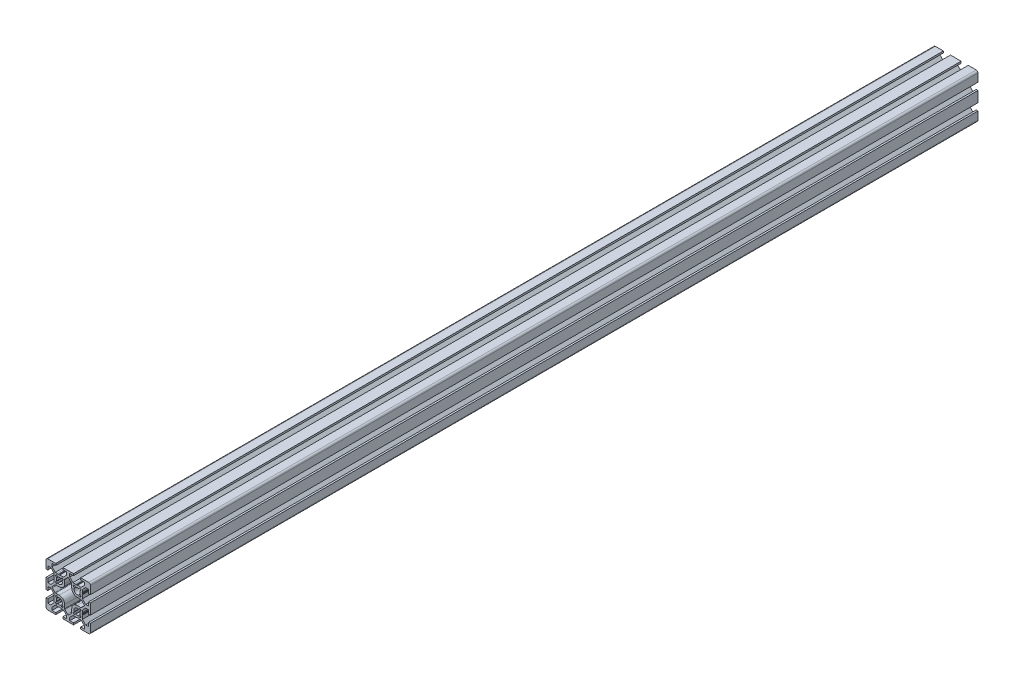
from build123d import *

# Parameters (mm, degrees)
BOSS_EXTRUDE1_DEPTH = 1000
CUT_EXTRUDE1_DEPTH  = 1001.624804809
CUT_EXTRUDE2_DEPTH  = 1001.624804809
CUT_EXTRUDE3_DEPTH  = 1001.624804809
CUT_EXTRUDE4_DEPTH  = 1001.624804809


with BuildPart() as part:
    # Sketch1 → Boss-Extrude1 (new body)
    with BuildSketch(Plane.XY):
        with BuildLine():
            Line((-25, 23), (-25, 14))
            Line((-25, 14), (-23, 14))
            Line((-23, 14), (-23, 18.25))
            Line((-23, 18.25), (-19.664213562, 18.25))
            Line((-19.664213562, 18.25), (-16, 14.585786438))
            Line((-16, 14.585786438), (-16, 10.653589838))
            ThreePointArc((-16, 10.653589838), (-15.982962913, 10.524180316), (-15.933012702, 10.403589838))
            Line((-15.933012702, 10.403589838), (-15.7, 10))
            Line((-15.7, 10), (-15.933012702, 9.596410162))
            ThreePointArc((-15.933012702, 9.596410162), (-16, 9.346410162), (-15.933012702, 9.096410162))
            Line((-15.933012702, 9.096410162), (-15.750976592, 8.781114371))
            Line((-15.750976592, 8.781114371), (-16, 7.5))
            Line((-16, 7.5), (-16, 5.414213562))
            Line((-16, 5.414213562), (-19.664213562, 1.75))
            Line((-19.664213562, 1.75), (-23, 1.75))
            Line((-23, 1.75), (-23, 6))
            Line((-23, 6), (-25, 6))
            Line((-25, 6), (-25, -6))
            Line((-25, -6), (-23, -6))
            Line((-23, -6), (-23, -1.75))
            Line((-23, -1.75), (-19.664213562, -1.75))
            Line((-19.664213562, -1.75), (-16, -5.414213562))
            Line((-16, -5.414213562), (-16, -9.346410162))
            ThreePointArc((-16, -9.346410162), (-15.982962913, -9.475819684), (-15.933012702, -9.596410162))
            Line((-15.933012702, -9.596410162), (-15.7, -10))
            Line((-15.7, -10), (-15.933012702, -10.403589838))
            ThreePointArc((-15.933012702, -10.403589838), (-16, -10.653589838), (-15.933012702, -10.903589838))
            Line((-15.933012702, -10.903589838), (-15.750976592, -11.218885629))
            Line((-15.750976592, -11.218885629), (-16, -12.5))
            Line((-16, -12.5), (-16, -14.585786438))
            Line((-16, -14.585786438), (-19.664213562, -18.25))
            Line((-19.664213562, -18.25), (-23, -18.25))
            Line((-23, -18.25), (-23, -14))
            Line((-23, -14), (-25, -14))
            Line((-25, -14), (-25, -23))
            ThreePointArc((-25, -23), (-24.414213562, -24.414213562), (-23, -25))
            Line((-23, -25), (-14, -25))
            Line((-14, -25), (-14, -23))
            Line((-14, -23), (-18.25, -23))
            Line((-18.25, -23), (-18.25, -19.664213562))
            Line((-18.25, -19.664213562), (-14.585786438, -16))
            Line((-14.585786438, -16), (-10.653589838, -16))
            ThreePointArc((-10.653589838, -16), (-10.524180316, -15.982962913), (-10.403589838, -15.933012702))
            Line((-10.403589838, -15.933012702), (-10, -15.7))
            Line((-10, -15.7), (-9.596410162, -15.933012702))
            ThreePointArc((-9.596410162, -15.933012702), (-9.346410162, -16), (-9.096410162, -15.933012702))
            Line((-9.096410162, -15.933012702), (-8.781114371, -15.750976592))
            Line((-8.781114371, -15.750976592), (-7.5, -16))
            Line((-7.5, -16), (-5.414213562, -16))
            Line((-5.414213562, -16), (-1.75, -19.664213562))
            Line((-1.75, -19.664213562), (-1.75, -23))
            Line((-1.75, -23), (-6, -23))
            Line((-6, -23), (-6, -25))
            Line((-6, -25), (6, -25))
            Line((6, -25), (6, -23))
            Line((6, -23), (1.75, -23))
            Line((1.75, -23), (1.75, -19.664213562))
            Line((1.75, -19.664213562), (5.414213562, -16))
            Line((5.414213562, -16), (9.346410162, -16))
            ThreePointArc((9.346410162, -16), (9.475819684, -15.982962913), (9.596410162, -15.933012702))
            Line((9.596410162, -15.933012702), (10, -15.7))
            Line((10, -15.7), (10.403589838, -15.933012702))
            ThreePointArc((10.403589838, -15.933012702), (10.653589838, -16), (10.903589838, -15.933012702))
            Line((10.903589838, -15.933012702), (11.218885629, -15.750976592))
            Line((11.218885629, -15.750976592), (12.5, -16))
            Line((12.5, -16), (14.585786438, -16))
            Line((14.585786438, -16), (18.25, -19.664213562))
            Line((18.25, -19.664213562), (18.25, -23))
            Line((18.25, -23), (14, -23))
            Line((14, -23), (14, -25))
            Line((14, -25), (23, -25))
            ThreePointArc((23, -25), (24.414213562, -24.414213562), (25, -23))
            Line((25, -23), (25, -14))
            Line((25, -14), (23, -14))
            Line((23, -14), (23, -18.25))
            Line((23, -18.25), (19.664213562, -18.25))
            Line((19.664213562, -18.25), (16, -14.585786438))
            Line((16, -14.585786438), (16, -10.653589838))
            ThreePointArc((16, -10.653589838), (15.982962913, -10.524180316), (15.933012702, -10.403589838))
            Line((15.933012702, -10.403589838), (15.7, -10))
            Line((15.7, -10), (15.933012702, -9.596410162))
            ThreePointArc((15.933012702, -9.596410162), (16, -9.346410162), (15.933012702, -9.096410162))
            Line((15.933012702, -9.096410162), (15.750976592, -8.781114371))
            Line((15.750976592, -8.781114371), (16, -7.5))
            Line((16, -7.5), (16, -5.414213562))
            Line((16, -5.414213562), (19.664213562, -1.75))
            Line((19.664213562, -1.75), (23, -1.75))
            Line((23, -1.75), (23, -6))
            Line((23, -6), (25, -6))
            Line((25, -6), (25, 6))
            Line((25, 6), (23, 6))
            Line((23, 6), (23, 1.75))
            Line((23, 1.75), (19.664213562, 1.75))
            Line((19.664213562, 1.75), (16, 5.414213562))
            Line((16, 5.414213562), (16, 9.346410162))
            ThreePointArc((16, 9.346410162), (15.982962913, 9.475819684), (15.933012702, 9.596410162))
            Line((15.933012702, 9.596410162), (15.7, 10))
            Line((15.7, 10), (15.933012702, 10.403589838))
            ThreePointArc((15.933012702, 10.403589838), (16, 10.653589838), (15.933012702, 10.903589838))
            Line((15.933012702, 10.903589838), (15.750976592, 11.218885629))
            Line((15.750976592, 11.218885629), (16, 12.5))
            Line((16, 12.5), (16, 14.585786438))
            Line((16, 14.585786438), (19.664213562, 18.25))
            Line((19.664213562, 18.25), (23, 18.25))
            Line((23, 18.25), (23, 14))
            Line((23, 14), (25, 14))
            Line((25, 14), (25, 23))
            ThreePointArc((25, 23), (24.414213562, 24.414213562), (23, 25))
            Line((23, 25), (14, 25))
            Line((14, 25), (14, 23))
            Line((14, 23), (18.25, 23))
            Line((18.25, 23), (18.25, 19.664213562))
            Line((18.25, 19.664213562), (14.585786438, 16))
            Line((14.585786438, 16), (10.653589838, 16))
            ThreePointArc((10.653589838, 16), (10.524180316, 15.982962913), (10.403589838, 15.933012702))
            Line((10.403589838, 15.933012702), (10, 15.7))
            Line((10, 15.7), (9.596410162, 15.933012702))
            ThreePointArc((9.596410162, 15.933012702), (9.346410162, 16), (9.096410162, 15.933012702))
            Line((9.096410162, 15.933012702), (8.781114371, 15.750976592))
            Line((8.781114371, 15.750976592), (7.5, 16))
            Line((7.5, 16), (5.414213562, 16))
            Line((5.414213562, 16), (1.75, 19.664213562))
            Line((1.75, 19.664213562), (1.75, 23))
            Line((1.75, 23), (6, 23))
            Line((6, 23), (6, 25))
            Line((6, 25), (-6, 25))
            Line((-6, 25), (-6, 23))
            Line((-6, 23), (-1.75, 23))
            Line((-1.75, 23), (-1.75, 19.664213562))
            Line((-1.75, 19.664213562), (-5.414213562, 16))
            Line((-5.414213562, 16), (-9.346410162, 16))
            ThreePointArc((-9.346410162, 16), (-9.475819684, 15.982962913), (-9.596410162, 15.933012702))
            Line((-9.596410162, 15.933012702), (-10, 15.7))
            Line((-10, 15.7), (-10.403589838, 15.933012702))
            ThreePointArc((-10.403589838, 15.933012702), (-10.653589838, 16), (-10.903589838, 15.933012702))
            Line((-10.903589838, 15.933012702), (-11.218885629, 15.750976592))
            Line((-11.218885629, 15.750976592), (-12.5, 16))
            Line((-12.5, 16), (-14.585786438, 16))
            Line((-14.585786438, 16), (-18.25, 19.664213562))
            Line((-18.25, 19.664213562), (-18.25, 23))
            Line((-18.25, 23), (-14, 23))
            Line((-14, 23), (-14, 25))
            Line((-14, 25), (-23, 25))
            ThreePointArc((-23, 25), (-24.414213562, 24.414213562), (-25, 23))
        make_face()
        with BuildLine():
            Line((-17.878679656, -0.707106781), (-14.878679656, -3.707106781))
            ThreePointArc((-14.878679656, -3.707106781), (-14.554256308, -3.923879533), (-14.171572875, -4))
            Line((-14.171572875, -4), (-10, -4))
            ThreePointArc((-10, -4), (-5.757359313, -5.757359313), (-4, -10))
            Line((-4, -10), (-4, -14.171572875))
            ThreePointArc((-4, -14.171572875), (-3.923879533, -14.554256308), (-3.707106781, -14.878679656))
            Line((-3.707106781, -14.878679656), (-0.707106781, -17.878679656))
            ThreePointArc((-0.707106781, -17.878679656), (0, -18.171572875), (0.707106781, -17.878679656))
            Line((0.707106781, -17.878679656), (3.707106781, -14.878679656))
            ThreePointArc((3.707106781, -14.878679656), (3.923879533, -14.554256308), (4, -14.171572875))
            Line((4, -14.171572875), (4, -10))
            ThreePointArc((4, -10), (5.757359313, -5.757359313), (10, -4))
            Line((10, -4), (14.171572875, -4))
            ThreePointArc((14.171572875, -4), (14.554256308, -3.923879533), (14.878679656, -3.707106781))
            Line((14.878679656, -3.707106781), (17.878679656, -0.707106781))
            ThreePointArc((17.878679656, -0.707106781), (18.171572875, 0), (17.878679656, 0.707106781))
            Line((17.878679656, 0.707106781), (14.878679656, 3.707106781))
            ThreePointArc((14.878679656, 3.707106781), (14.554256308, 3.923879533), (14.171572875, 4))
            Line((14.171572875, 4), (10, 4))
            ThreePointArc((10, 4), (5.757359313, 5.757359313), (4, 10))
            Line((4, 10), (4, 14.171572875))
            ThreePointArc((4, 14.171572875), (3.923879533, 14.554256308), (3.707106781, 14.878679656))
            Line((3.707106781, 14.878679656), (0.707106781, 17.878679656))
            ThreePointArc((0.707106781, 17.878679656), (0, 18.171572875), (-0.707106781, 17.878679656))
            Line((-0.707106781, 17.878679656), (-3.707106781, 14.878679656))
            ThreePointArc((-3.707106781, 14.878679656), (-3.923879533, 14.554256308), (-4, 14.171572875))
            Line((-4, 14.171572875), (-4, 10))
            ThreePointArc((-4, 10), (-5.757359313, 5.757359313), (-10, 4))
            Line((-10, 4), (-14.171572875, 4))
            ThreePointArc((-14.171572875, 4), (-14.554256308, 3.923879533), (-14.878679656, 3.707106781))
            Line((-14.878679656, 3.707106781), (-17.878679656, 0.707106781))
            ThreePointArc((-17.878679656, 0.707106781), (-18.171572875, 0), (-17.878679656, -0.707106781))
        make_face(mode=Mode.SUBTRACT)
    extrude(amount=-BOSS_EXTRUDE1_DEPTH)

    # Sketch2 → Cut-Extrude1 (cut, through all)
    with BuildSketch(Plane.XY):
        with BuildLine():
            Line((-14.242640687, 12.828427125), (-13.205105981, 11.790892418))
            ThreePointArc((-13.205105981, 11.790892418), (-13.095045749, 11.583064884), (-13.120796199, 11.349307631))
            ThreePointArc((-13.120796199, 11.349307631), (-13.4, 10.000000021), (-13.120796216, 8.650692407))
            ThreePointArc((-13.120796216, 8.650692407), (-13.095045745, 8.416935137), (-13.205105981, 8.209107582))
            Line((-13.205105981, 8.209107582), (-14.242640687, 7.171572875))
            ThreePointArc((-14.242640687, 7.171572875), (-14.389087297, 6.818019485), (-14.242640687, 6.464466094))
            Line((-14.242640687, 6.464466094), (-13.535533906, 5.757359313))
            ThreePointArc((-13.535533906, 5.757359313), (-13.181980515, 5.610912703), (-12.828427125, 5.757359313))
            Line((-12.828427125, 5.757359313), (-11.790892418, 6.794894019))
            ThreePointArc((-11.790892418, 6.794894019), (-11.583064884, 6.904954251), (-11.349307631, 6.879203801))
            ThreePointArc((-11.349307631, 6.879203801), (-7.595836944, 7.595836944), (-6.879203801, 11.349307631))
            ThreePointArc((-6.879203801, 11.349307631), (-6.904954251, 11.583064884), (-6.794894019, 11.790892418))
            Line((-6.794894019, 11.790892418), (-5.757359313, 12.828427125))
            ThreePointArc((-5.757359313, 12.828427125), (-5.610912703, 13.181980515), (-5.757359313, 13.535533906))
            Line((-5.757359313, 13.535533906), (-6.464466094, 14.242640687))
            ThreePointArc((-6.464466094, 14.242640687), (-6.818019485, 14.389087297), (-7.171572875, 14.242640687))
            Line((-7.171572875, 14.242640687), (-8.209107582, 13.205105981))
            ThreePointArc((-8.209107582, 13.205105981), (-8.416935116, 13.095045749), (-8.650692369, 13.120796199))
            ThreePointArc((-8.650692369, 13.120796199), (-9.999999979, 13.4), (-11.349307593, 13.120796216))
            ThreePointArc((-11.349307593, 13.120796216), (-11.583064863, 13.095045745), (-11.790892418, 13.205105981))
            Line((-11.790892418, 13.205105981), (-12.828427125, 14.242640687))
            ThreePointArc((-12.828427125, 14.242640687), (-13.181980515, 14.389087297), (-13.535533906, 14.242640687))
            Line((-13.535533906, 14.242640687), (-14.242640687, 13.535533906))
            ThreePointArc((-14.242640687, 13.535533906), (-14.389087297, 13.181980515), (-14.242640687, 12.828427125))
        make_face()
    extrude(amount=-CUT_EXTRUDE1_DEPTH, mode=Mode.SUBTRACT)

    # Sketch3 → Cut-Extrude2 (cut, through all)
    with BuildSketch(Plane.XY):
        with BuildLine():
            Line((-12.828427125, -14.242640687), (-11.790892418, -13.205105981))
            ThreePointArc((-11.790892418, -13.205105981), (-11.583064884, -13.095045749), (-11.349307631, -13.120796199))
            ThreePointArc((-11.349307631, -13.120796199), (-10.000000021, -13.4), (-8.650692407, -13.120796216))
            ThreePointArc((-8.650692407, -13.120796216), (-8.416935137, -13.095045745), (-8.209107582, -13.205105981))
            Line((-8.209107582, -13.205105981), (-7.171572875, -14.242640687))
            ThreePointArc((-7.171572875, -14.242640687), (-6.818019485, -14.389087297), (-6.464466094, -14.242640687))
            Line((-6.464466094, -14.242640687), (-5.757359313, -13.535533906))
            ThreePointArc((-5.757359313, -13.535533906), (-5.610912703, -13.181980515), (-5.757359313, -12.828427125))
            Line((-5.757359313, -12.828427125), (-6.794894019, -11.790892418))
            ThreePointArc((-6.794894019, -11.790892418), (-6.904954251, -11.583064884), (-6.879203801, -11.349307631))
            ThreePointArc((-6.879203801, -11.349307631), (-7.595836944, -7.595836944), (-11.349307631, -6.879203801))
            ThreePointArc((-11.349307631, -6.879203801), (-11.583064884, -6.904954251), (-11.790892418, -6.794894019))
            Line((-11.790892418, -6.794894019), (-12.828427125, -5.757359313))
            ThreePointArc((-12.828427125, -5.757359313), (-13.181980515, -5.610912703), (-13.535533906, -5.757359313))
            Line((-13.535533906, -5.757359313), (-14.242640687, -6.464466094))
            ThreePointArc((-14.242640687, -6.464466094), (-14.389087297, -6.818019485), (-14.242640687, -7.171572875))
            Line((-14.242640687, -7.171572875), (-13.205105981, -8.209107582))
            ThreePointArc((-13.205105981, -8.209107582), (-13.095045749, -8.416935116), (-13.120796199, -8.650692369))
            ThreePointArc((-13.120796199, -8.650692369), (-13.4, -9.999999979), (-13.120796216, -11.349307593))
            ThreePointArc((-13.120796216, -11.349307593), (-13.095045745, -11.583064863), (-13.205105981, -11.790892418))
            Line((-13.205105981, -11.790892418), (-14.242640687, -12.828427125))
            ThreePointArc((-14.242640687, -12.828427125), (-14.389087297, -13.181980515), (-14.242640687, -13.535533906))
            Line((-14.242640687, -13.535533906), (-13.535533906, -14.242640687))
            ThreePointArc((-13.535533906, -14.242640687), (-13.181980515, -14.389087297), (-12.828427125, -14.242640687))
        make_face()
    extrude(amount=-CUT_EXTRUDE2_DEPTH, mode=Mode.SUBTRACT)

    # Sketch4 → Cut-Extrude3 (cut, through all)
    with BuildSketch(Plane.XY):
        with BuildLine():
            Line((14.242640687, -12.828427125), (13.205105981, -11.790892418))
            ThreePointArc((13.205105981, -11.790892418), (13.095045749, -11.583064884), (13.120796199, -11.349307631))
            ThreePointArc((13.120796199, -11.349307631), (13.4, -10.000000021), (13.120796216, -8.650692407))
            ThreePointArc((13.120796216, -8.650692407), (13.095045745, -8.416935137), (13.205105981, -8.209107582))
            Line((13.205105981, -8.209107582), (14.242640687, -7.171572875))
            ThreePointArc((14.242640687, -7.171572875), (14.389087297, -6.818019485), (14.242640687, -6.464466094))
            Line((14.242640687, -6.464466094), (13.535533906, -5.757359313))
            ThreePointArc((13.535533906, -5.757359313), (13.181980515, -5.610912703), (12.828427125, -5.757359313))
            Line((12.828427125, -5.757359313), (11.790892418, -6.794894019))
            ThreePointArc((11.790892418, -6.794894019), (11.583064884, -6.904954251), (11.349307631, -6.879203801))
            ThreePointArc((11.349307631, -6.879203801), (7.595836944, -7.595836944), (6.879203801, -11.349307631))
            ThreePointArc((6.879203801, -11.349307631), (6.904954251, -11.583064884), (6.794894019, -11.790892418))
            Line((6.794894019, -11.790892418), (5.757359313, -12.828427125))
            ThreePointArc((5.757359313, -12.828427125), (5.610912703, -13.181980515), (5.757359313, -13.535533906))
            Line((5.757359313, -13.535533906), (6.464466094, -14.242640687))
            ThreePointArc((6.464466094, -14.242640687), (6.818019485, -14.389087297), (7.171572875, -14.242640687))
            Line((7.171572875, -14.242640687), (8.209107582, -13.205105981))
            ThreePointArc((8.209107582, -13.205105981), (8.416935116, -13.095045749), (8.650692369, -13.120796199))
            ThreePointArc((8.650692369, -13.120796199), (9.999999979, -13.4), (11.349307593, -13.120796216))
            ThreePointArc((11.349307593, -13.120796216), (11.583064863, -13.095045745), (11.790892418, -13.205105981))
            Line((11.790892418, -13.205105981), (12.828427125, -14.242640687))
            ThreePointArc((12.828427125, -14.242640687), (13.181980515, -14.389087297), (13.535533906, -14.242640687))
            Line((13.535533906, -14.242640687), (14.242640687, -13.535533906))
            ThreePointArc((14.242640687, -13.535533906), (14.389087297, -13.181980515), (14.242640687, -12.828427125))
        make_face()
    extrude(amount=-CUT_EXTRUDE3_DEPTH, mode=Mode.SUBTRACT)

    # Sketch5 → Cut-Extrude4 (cut, through all)
    with BuildSketch(Plane.XY):
        with BuildLine():
            Line((12.828427125, 14.242640687), (11.790892418, 13.205105981))
            ThreePointArc((11.790892418, 13.205105981), (11.583064884, 13.095045749), (11.349307631, 13.120796199))
            ThreePointArc((11.349307631, 13.120796199), (10.000000021, 13.4), (8.650692407, 13.120796216))
            ThreePointArc((8.650692407, 13.120796216), (8.416935137, 13.095045745), (8.209107582, 13.205105981))
            Line((8.209107582, 13.205105981), (7.171572875, 14.242640687))
            ThreePointArc((7.171572875, 14.242640687), (6.818019485, 14.389087297), (6.464466094, 14.242640687))
            Line((6.464466094, 14.242640687), (5.757359313, 13.535533906))
            ThreePointArc((5.757359313, 13.535533906), (5.610912703, 13.181980515), (5.757359313, 12.828427125))
            Line((5.757359313, 12.828427125), (6.794894019, 11.790892418))
            ThreePointArc((6.794894019, 11.790892418), (6.904954251, 11.583064884), (6.879203801, 11.349307631))
            ThreePointArc((6.879203801, 11.349307631), (7.595836944, 7.595836944), (11.349307631, 6.879203801))
            ThreePointArc((11.349307631, 6.879203801), (11.583064884, 6.904954251), (11.790892418, 6.794894019))
            Line((11.790892418, 6.794894019), (12.828427125, 5.757359313))
            ThreePointArc((12.828427125, 5.757359313), (13.181980515, 5.610912703), (13.535533906, 5.757359313))
            Line((13.535533906, 5.757359313), (14.242640687, 6.464466094))
            ThreePointArc((14.242640687, 6.464466094), (14.389087297, 6.818019485), (14.242640687, 7.171572875))
            Line((14.242640687, 7.171572875), (13.205105981, 8.209107582))
            ThreePointArc((13.205105981, 8.209107582), (13.095045749, 8.416935116), (13.120796199, 8.650692369))
            ThreePointArc((13.120796199, 8.650692369), (13.4, 9.999999979), (13.120796216, 11.349307593))
            ThreePointArc((13.120796216, 11.349307593), (13.095045745, 11.583064863), (13.205105981, 11.790892418))
            Line((13.205105981, 11.790892418), (14.242640687, 12.828427125))
            ThreePointArc((14.242640687, 12.828427125), (14.389087297, 13.181980515), (14.242640687, 13.535533906))
            Line((14.242640687, 13.535533906), (13.535533906, 14.242640687))
            ThreePointArc((13.535533906, 14.242640687), (13.181980515, 14.389087297), (12.828427125, 14.242640687))
        make_face()
    extrude(amount=-CUT_EXTRUDE4_DEPTH, mode=Mode.SUBTRACT)


solid = part.part
